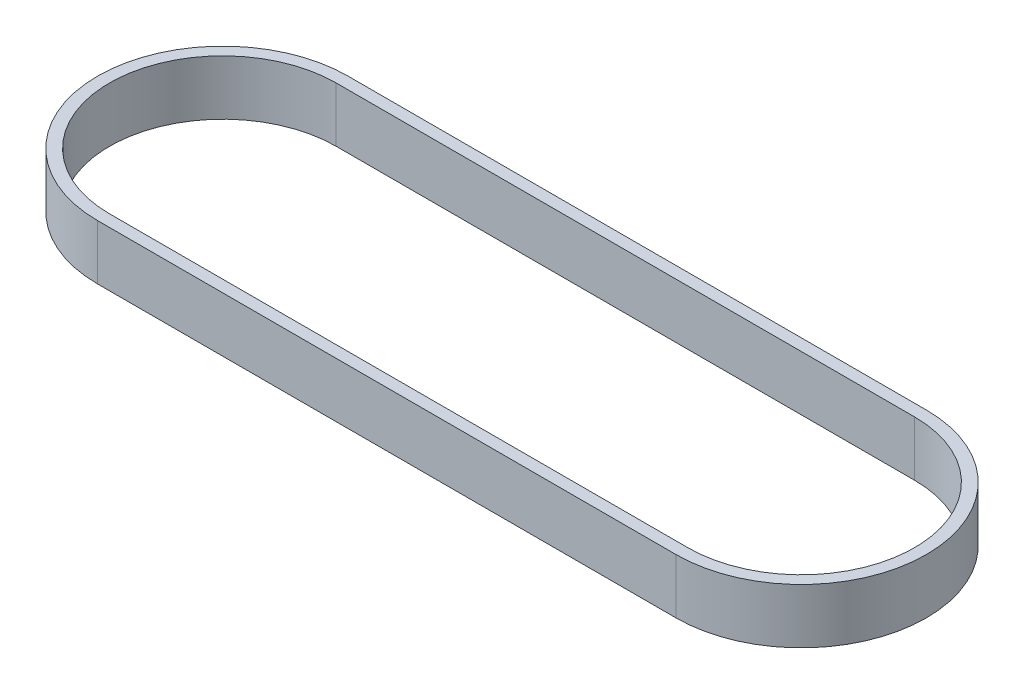
from build123d import *

# Parameters (mm, degrees)
BOSS_EXTRUDE1_DEPTH = 9.25


with BuildPart() as part:
    # Sketch1 → Boss-Extrude1 (new body)
    with BuildSketch(Plane(origin=(0, 0, 0), x_dir=(1, 0, 0), z_dir=(0, 1, 0))):
        with BuildLine():
            Line((-48.745, -21.1), (48.745, -21.1))
            ThreePointArc((48.745, -21.1), (69.845, 0), (48.745, 21.1))
            Line((48.745, 21.1), (-48.745, 21.1))
            ThreePointArc((-48.745, 21.1), (-69.845, 0), (-48.745, -21.1))
        make_face()
        with BuildLine():
            Line((-48.745, 19.1), (48.745, 19.1))
            ThreePointArc((48.745, 19.1), (67.845, 0), (48.745, -19.1))
            Line((48.745, -19.1), (-48.745, -19.1))
            ThreePointArc((-48.745, -19.1), (-67.845, 0), (-48.745, 19.1))
        make_face(mode=Mode.SUBTRACT)
    extrude(amount=BOSS_EXTRUDE1_DEPTH)


solid = part.part
